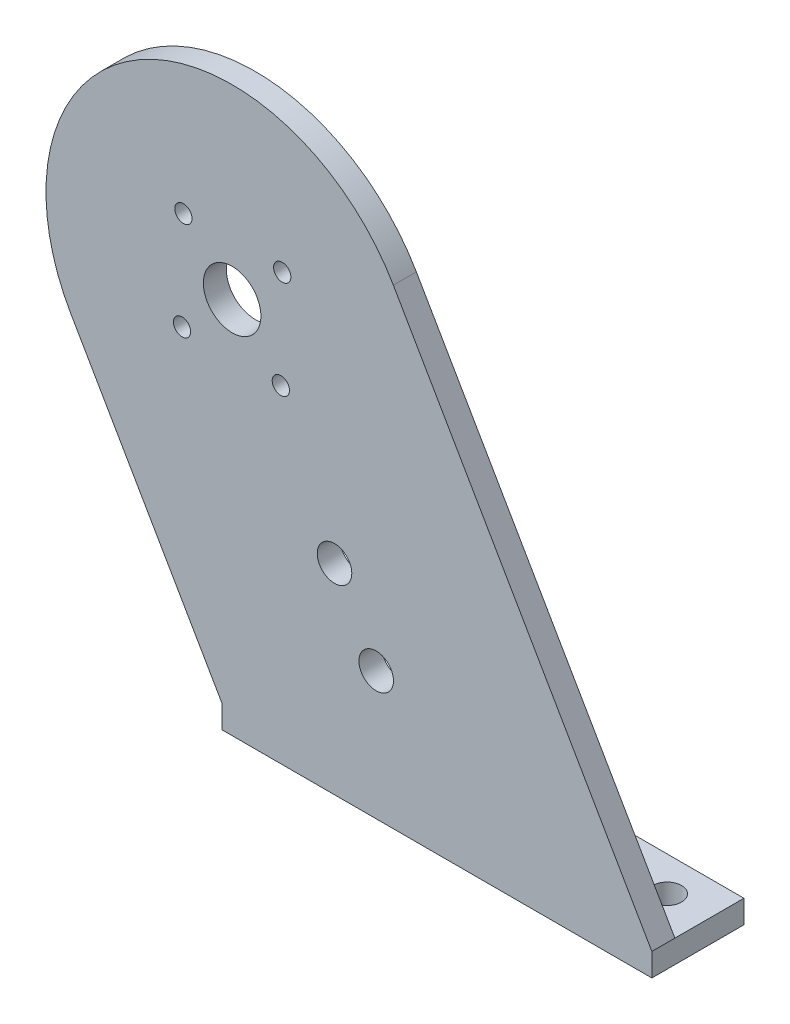
from build123d import *

# Parameters (mm, degrees)
SKETCH_1_R          = 5
SKETCH_1_R_2        = 1.5
SKETCH_1_R_3        = 3
EXTRUDE_1_DEPTH     = 4
SKETCH_2_W          = 74.681955409
SKETCH_2_H          = 4
EXTRUDE_2_DEPTH     = 12
SKETCH_3_R          = 2.5
CUT_EXTRUDE_1_DEPTH = 109.876048253


with BuildPart() as part:
    # 草图1 → 凸台-拉伸1 (new body)
    with BuildSketch(Plane.XY):
        with BuildLine():
            Line((-49.360062144, -0.241015089), (-23.122201524, -45.686322765))
            Line((-23.122201524, -45.686322765), (-23.122201524, -49.686322765))
            Line((-23.122201524, -49.686322765), (51.559753885, -49.686322765))
            Line((51.559753885, -49.686322765), (51.559753885, -45.686322765))
            Line((51.559753885, -45.686322765), (6.651404412, 32.097220205))
            ThreePointArc((6.651404412, 32.097220205), (-37.523446513, 43.933835837), (-49.360062144, -0.241015089))
        make_face()
        with Locations((-21.354328866, 15.928102558)):
            Circle(SKETCH_1_R, mode=Mode.SUBTRACT)
        with Locations((-29.816939203, 24.632935589)):
            Circle(SKETCH_1_R_2, mode=Mode.SUBTRACT)
        with Locations((-12.649495836, 24.390712895)):
            Circle(SKETCH_1_R_2, mode=Mode.SUBTRACT)
        with Locations((-12.89171853, 7.223269528)):
            Circle(SKETCH_1_R_2, mode=Mode.SUBTRACT)
        with Locations((-30.059161896, 7.465492222)):
            Circle(SKETCH_1_R_2, mode=Mode.SUBTRACT)
        with Locations((-3.567776343, -14.879110103)):
            Circle(SKETCH_1_R_3, mode=Mode.SUBTRACT)
        with Locations((3.675910259, -27.425543331)):
            Circle(SKETCH_1_R_3, mode=Mode.SUBTRACT)
    extrude(amount=EXTRUDE_1_DEPTH)

    # 草图2 → 凸台-拉伸2 (add)
    with BuildSketch(Plane(origin=(0, 0, 0), x_dir=(-1, 0, 0), z_dir=(0, 0, -1))):
        with Locations((-14.218776181, -47.686322765)):
            Rectangle(SKETCH_2_W, SKETCH_2_H)
    extrude(amount=EXTRUDE_2_DEPTH)

    # 草图3 → 切除-拉伸1 (cut, through all)
    with BuildSketch(Plane(origin=(0, -45.686322765, 0), x_dir=(1, 0, 0), z_dir=(0, 1, 0))):
        with Locations(Location((24.21877618, 6, 0), (0, 0, 270))):
            Circle(SKETCH_3_R)
        with Locations(Location((44.21877618, 6, 0), (0, 0, 270))):
            Circle(SKETCH_3_R)
        with Locations(Location((-15.78122382, 6, 0), (0, 0, 90))):
            Circle(SKETCH_3_R)
        with Locations(Location((4.21877618, 6, 0), (0, 0, 90))):
            Circle(SKETCH_3_R)
    extrude(amount=-CUT_EXTRUDE_1_DEPTH, mode=Mode.SUBTRACT)


solid = part.part
